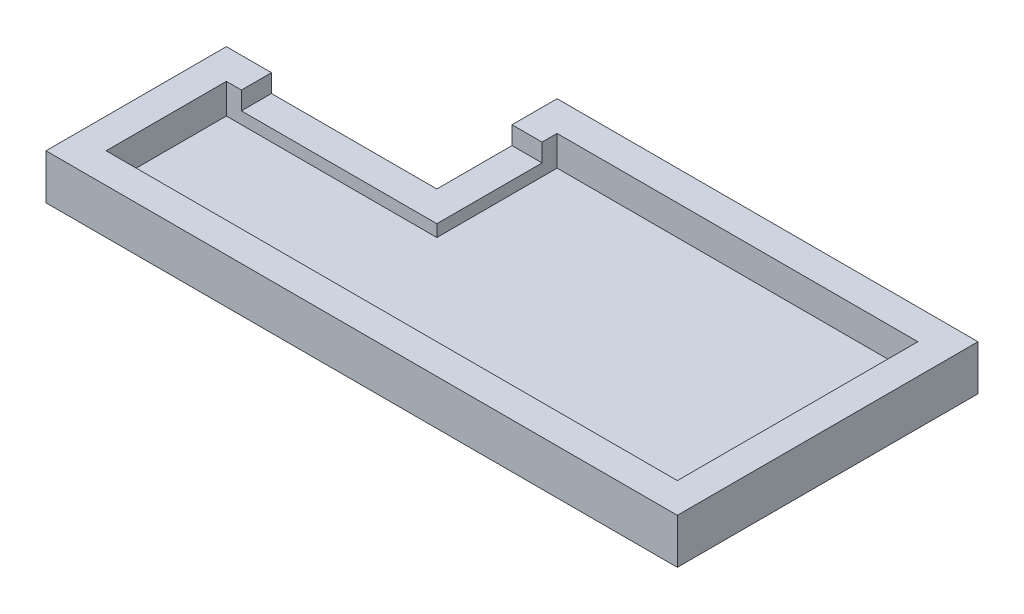
from build123d import *

# Parameters (mm, degrees)
BOSS_EXTRUDE1_DEPTH = 19.05
CUT_EXTRUDE1_DEPTH  = 12.7
CUT_EXTRUDE2_DEPTH  = 7.62


with BuildPart() as part:
    # Sketch1 → Boss-Extrude1 (new body)
    with BuildSketch(Plane(origin=(0, 0, 0), x_dir=(1, 0, 0), z_dir=(0, 1, 0))):
        Polygon((0, 0), (0, 76.2), (88.9, 76.2), (88.9, 127), (266.7, 127), (266.7, 0), align=None)
    extrude(amount=BOSS_EXTRUDE1_DEPTH)

    # Sketch2 → Cut-Extrude1 (cut)
    with BuildSketch(Plane(origin=(0, 19.05, 0), x_dir=(1, 0, 0), z_dir=(0, 1, 0))):
        Polygon((12.7, 63.5), (101.6, 63.5), (101.6, 114.3), (254, 114.3), (254, 12.7), (12.7, 12.7), align=None)
    extrude(amount=-CUT_EXTRUDE1_DEPTH, mode=Mode.SUBTRACT)

    # Sketch3 → Cut-Extrude2 (cut)
    with BuildSketch(Plane(origin=(0, 19.05, 0), x_dir=(1, 0, 0), z_dir=(0, 1, 0))):
        Polygon((19.05, 76.2), (19.05, 63.5), (101.6, 63.5), (101.6, 107.95), (88.9, 107.95), (88.9, 76.2), align=None)
    extrude(amount=-CUT_EXTRUDE2_DEPTH, mode=Mode.SUBTRACT)


solid = part.part
